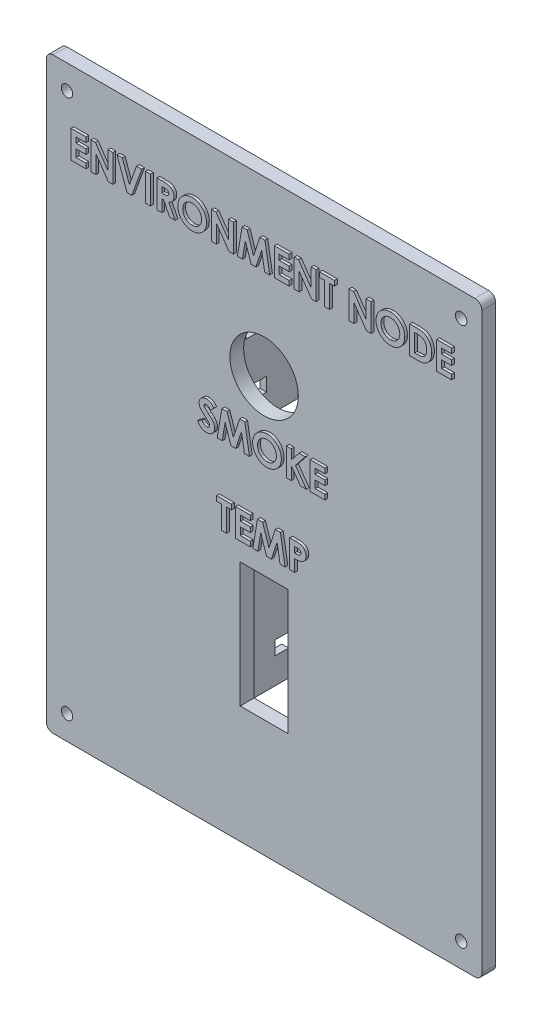
from build123d import *

# Parameters (mm, degrees)
PANEL_DEPTH            = 4
SKETCH2_R              = 1.65
SCREW_HOLES_DEPTH      = 182.34221792
SKETCH3_W              = 30
SKETCH3_H              = 2
SKETCH3_W_2            = 2
SKETCH3_H_2            = 30
LOCATING_TABS_DEPTH    = 3
SKETCH4_R              = 9.905
MQ_2_CAN_HOLE_DEPTH    = 182.34221792
SKETCH5_W              = 2
SKETCH5_H              = 32.52
MQ_2_RAILS_DEPTH       = 16
SKETCH6_W              = 6
SKETCH6_H              = 4
MQ_2_TIE_SLOTS_DEPTH   = 188.002840888
SKETCH7_W              = 13.8
SKETCH7_H              = 36.1
DHT22_WINDOW_DEPTH     = 183.002747232
SKETCH8_W              = 2
SKETCH8_H              = 38.1
DHT22_RAILS_DEPTH      = 11
SKETCH9_W              = 4
SKETCH9_H              = 4
DHT22_TIE_SLOTS_DEPTH  = 187.057007393
SKETCH10_W             = 19.8
SKETCH10_H             = 2
DHT22_POCKET_TOP_DEPTH = 11
SKETCH11_W             = 1.435897436
SKETCH11_H             = 8
LABELS_RAISED_DEPTH    = 0.8


with BuildPart() as part:
    # Sketch1 → Panel (new body)
    with BuildSketch(Plane.XY):
        with BuildLine():
            Line((-61, 0), (61, 0))
            ThreePointArc((61, 0), (62.414213562, 0.585786438), (63, 2))
            Line((63, 2), (63, 168))
            ThreePointArc((63, 168), (62.414213562, 169.414213562), (61, 170))
            Line((61, 170), (-61, 170))
            ThreePointArc((-61, 170), (-62.414213562, 169.414213562), (-63, 168))
            Line((-63, 168), (-63, 2))
            ThreePointArc((-63, 2), (-62.414213562, 0.585786438), (-61, 0))
        make_face()
    extrude(amount=PANEL_DEPTH)

    # Sketch2 → Screw holes (cut, through all)
    with BuildSketch(Plane.XY):
        with Locations((-57, 7)):
            Circle(SKETCH2_R)
        with Locations((57, 7)):
            Circle(SKETCH2_R)
        with Locations((-57, 163)):
            Circle(SKETCH2_R)
        with Locations((57, 163)):
            Circle(SKETCH2_R)
    extrude(amount=SCREW_HOLES_DEPTH, mode=Mode.SUBTRACT)

    # Sketch3 → Locating tabs (add)
    with BuildSketch(Plane.XY.offset(-3)):
        with Locations((0, 4.3)):
            Rectangle(SKETCH3_W, SKETCH3_H)
        with Locations((0, 165.7)):
            Rectangle(SKETCH3_W, SKETCH3_H)
        with Locations((-57.457359313, 85)):
            Rectangle(SKETCH3_W_2, SKETCH3_H_2)
        with Locations((57.457359313, 85)):
            Rectangle(SKETCH3_W_2, SKETCH3_H_2)
    extrude(amount=LOCATING_TABS_DEPTH)

    # Sketch4 → MQ-2 can hole (cut, through all)
    with BuildSketch(Plane.XY):
        with Locations((0, 120)):
            Circle(SKETCH4_R)
    extrude(amount=MQ_2_CAN_HOLE_DEPTH, mode=Mode.SUBTRACT)

    # Sketch5 → MQ-2 rails (add)
    with BuildSketch(Plane.XY.offset(-16)):
        with Locations((-11.25, 115.54)):
            Rectangle(SKETCH5_W, SKETCH5_H)
        with Locations((11.25, 115.54)):
            Rectangle(SKETCH5_W, SKETCH5_H)
    extrude(amount=MQ_2_RAILS_DEPTH)

    # Sketch6 → MQ-2 tie slots (cut, through all)
    with BuildSketch(Plane(origin=(-13.25, 0, 0), x_dir=(0, 0, -1), z_dir=(1, 0, 0))):
        with Locations((4, 107.41)):
            Rectangle(SKETCH6_W, SKETCH6_H)
        with Locations((4, 123.67)):
            Rectangle(SKETCH6_W, SKETCH6_H)
    extrude(amount=MQ_2_TIE_SLOTS_DEPTH, mode=Mode.SUBTRACT)

    # Sketch7 → DHT22 window (cut, through all)
    with BuildSketch(Plane.XY):
        with Locations((0, 52)):
            Rectangle(SKETCH7_W, SKETCH7_H)
    extrude(amount=DHT22_WINDOW_DEPTH, mode=Mode.SUBTRACT)

    # Sketch8 → DHT22 rails (add)
    with BuildSketch(Plane.XY.offset(-11)):
        with Locations((-8.9, 52)):
            Rectangle(SKETCH8_W, SKETCH8_H)
        with Locations((8.9, 52)):
            Rectangle(SKETCH8_W, SKETCH8_H)
    extrude(amount=DHT22_RAILS_DEPTH)

    # Sketch9 → DHT22 tie slots (cut, through all)
    with BuildSketch(Plane(origin=(-10.9, 0, 0), x_dir=(0, 0, -1), z_dir=(1, 0, 0))):
        with Locations((9, 42.475)):
            Rectangle(SKETCH9_W, SKETCH9_H)
        with Locations((9, 61.525)):
            Rectangle(SKETCH9_W, SKETCH9_H)
    extrude(amount=DHT22_TIE_SLOTS_DEPTH, mode=Mode.SUBTRACT)

    # Sketch10 → DHT22 pocket top (add)
    with BuildSketch(Plane.XY.offset(-11)):
        with Locations((0, 72.05)):
            Rectangle(SKETCH10_W, SKETCH10_H)
    extrude(amount=DHT22_POCKET_TOP_DEPTH)

    # Sketch11 → Labels (raised) (add)
    # profile 1 of 24: a face of its own
    with BuildSketch(Plane.XY.offset(4)):
        Polygon((-55.025641026, 155), (-50.717948718, 155), (-50.717948718, 153.564102564), (-53.58974359, 153.564102564), (-53.58974359, 152.025641026), (-50.717948718, 152.025641026), (-50.717948718, 150.58974359), (-53.58974359, 150.58974359), (-53.58974359, 148.435897436), (-50.717948718, 148.435897436), (-50.717948718, 147), (-55.025641026, 147), align=None)
    # profile 2 of 24: a face of its own
    with BuildSketch(Plane.XY.offset(4)):
        Polygon((-49.282051282, 155), (-47.988782051, 155), (-44.358974359, 149.735576923), (-44.358974359, 155), (-42.923076923, 155), (-42.923076923, 147), (-44.225961538, 147), (-47.846153846, 152.248397436), (-47.846153846, 147), (-49.282051282, 147), align=None)
    # profile 3 of 24: a face of its own
    with BuildSketch(Plane.XY.offset(4)):
        Polygon((-41.743589744, 155), (-40.209935897, 155), (-38.153846154, 149.317307692), (-36.096153846, 155), (-34.564102564, 155), (-37.463141026, 147), (-38.84775641, 147), align=None)
    # profile 4 of 24: a face of its own
    with BuildSketch(Plane.XY.offset(4)):
        with Locations((-32.769230769, 151)):
            Rectangle(SKETCH11_W, SKETCH11_H)
    # profile 5 of 24: a face of its own
    with BuildSketch(Plane.XY.offset(4)):
        with BuildLine():
            Line((-30.205128205, 155), (-28.532051282, 155))
            add(Edge.make_bspline(
                [(-28.532051282, 155), (-28.421461407, 154.999607469), (-28.208765925, 154.998852523), (-27.902070657, 154.98694146), (-27.620328877, 154.97036624), (-27.363123439, 154.945072013), (-27.13056438, 154.911534926), (-26.922418622, 154.87200025), (-26.738692249, 154.826942011), (-26.577835782, 154.770795889), (-26.432670775, 154.707463916), (-26.297356807, 154.634694317), (-26.16890865, 154.553297406), (-26.048184841, 154.461131408), (-25.934136263, 154.359854368), (-25.826547756, 154.249364341), (-25.726939644, 154.128724416), (-25.635928706, 153.998696884), (-25.552979563, 153.861910903), (-25.479669917, 153.718178664), (-25.420054391, 153.567400211), (-25.367377683, 153.411754618), (-25.329436357, 153.249016901), (-25.30304872, 153.08077134), (-25.283728724, 152.906425691), (-25.282617917, 152.787982999), (-25.282051282, 152.727564103)],
                knots=[0, 0, 0, 0, 1.749336639, 3.364467119, 4.854658419, 6.213483162, 7.451590619, 8.570285859, 9.5643256, 10.440900261, 11.26203566, 12.067320669, 12.869050712, 13.665104639, 14.467235401, 15.27997916, 16.102287765, 16.939272006, 17.78853747, 18.631303466, 19.488103222, 20.351255419, 21.228522269, 22.127379805, 23.044756219, 24, 24, 24, 24], degree=3))
            add(Edge.make_bspline(
                [(-25.282051282, 152.727564103), (-25.283523196, 152.664500654), (-25.28640935, 152.540844726), (-25.301955746, 152.359204253), (-25.330369676, 152.185423354), (-25.373406706, 152.020010837), (-25.422872182, 151.860907952), (-25.488648576, 151.711050245), (-25.562883738, 151.568258254), (-25.651050671, 151.434551826), (-25.747809573, 151.306961072), (-25.86033814, 151.19037447), (-25.98134625, 151.07852593), (-26.11763621, 150.978421265), (-26.263200231, 150.883291759), (-26.420930518, 150.797079093), (-26.589797668, 150.717616079), (-26.708519637, 150.673302013), (-26.769230769, 150.650641026)],
                knots=[0, 0, 0, 0, 1.099860209, 2.156625411, 3.176576793, 4.16617041, 5.135385252, 6.078461593, 7.016046972, 7.938469504, 8.868247731, 9.803980173, 10.76021508, 11.73834243, 12.748633912, 13.790971185, 14.870363756, 16, 16, 16, 16], degree=3))
            Line((-26.769230769, 150.650641026), (-24.923076923, 147))
            Line((-24.923076923, 147), (-26.519230769, 147))
            Line((-26.519230769, 147), (-28.282051282, 150.487179487))
            Line((-28.282051282, 150.487179487), (-28.769230769, 150.487179487))
            Line((-28.769230769, 150.487179487), (-28.769230769, 147))
            Line((-28.769230769, 147), (-30.205128205, 147))
            Line((-30.205128205, 147), (-30.205128205, 155))
        make_face()
        with BuildLine():
            Line((-28.769230769, 151.923076923), (-28.209935897, 151.923076923))
            add(Edge.make_bspline(
                [(-28.209935897, 151.923076923), (-28.14155745, 151.923847047), (-28.010627416, 151.925321669), (-27.822332831, 151.932161577), (-27.651316442, 151.948642376), (-27.496843847, 151.96946525), (-27.358137754, 151.993508265), (-27.236435372, 152.027963365), (-27.129861453, 152.064882876), (-27.039678902, 152.110764253), (-26.962629003, 152.162941328), (-26.896101347, 152.222215784), (-26.841073436, 152.290818418), (-26.795782658, 152.366884908), (-26.760551358, 152.451088043), (-26.734835207, 152.542503463), (-26.720463682, 152.642172507), (-26.718810189, 152.710957719), (-26.717948718, 152.746794872)],
                knots=[0, 0, 0, 0, 1.688639943, 3.233382647, 4.650958383, 5.928841754, 7.082724185, 8.122798841, 9.049171256, 9.863274652, 10.613301712, 11.341792392, 12.054588806, 12.776240173, 13.521029143, 14.301969904, 15.115324896, 16, 16, 16, 16], degree=3))
            add(Edge.make_bspline(
                [(-26.717948718, 152.746794872), (-26.719577408, 152.78919284), (-26.722776668, 152.872475792), (-26.754523268, 152.99237404), (-26.805056998, 153.103348072), (-26.8743249, 153.20489648), (-26.961558818, 153.293920824), (-27.061666621, 153.372396492), (-27.176808877, 153.434449179), (-27.283421942, 153.47537847), (-27.380414911, 153.499866888), (-27.467948006, 153.51811544), (-27.569311856, 153.531048712), (-27.684582987, 153.54476675), (-27.813467567, 153.553662203), (-27.956668096, 153.560154111), (-28.113773302, 153.562810269), (-28.223290552, 153.563659396), (-28.280448718, 153.564102564)],
                knots=[0, 0, 0, 0, 1.020303359, 2.004196876, 2.966617323, 3.9489082, 4.950758222, 5.960522915, 7.003732012, 8.091992268, 8.70421221, 9.413913587, 10.24622431, 11.166358409, 12.212345909, 13.359657661, 14.621978493, 16, 16, 16, 16], degree=3))
            Line((-28.280448718, 153.564102564), (-28.769230769, 153.564102564))
            Line((-28.769230769, 153.564102564), (-28.769230769, 151.923076923))
        make_face(mode=Mode.SUBTRACT)
    # profile 6 of 24: a face of its own
    with BuildSketch(Plane.XY.offset(4)):
        with BuildLine():
            add(Edge.make_bspline(
                [(-19.983974359, 155.205128205), (-19.844884554, 155.201526921), (-19.570289777, 155.19441717), (-19.166459951, 155.135151851), (-18.777295245, 155.038587509), (-18.402971639, 154.90435609), (-18.044426397, 154.728821924), (-17.700394809, 154.51696152), (-17.372109179, 154.26477614), (-17.062933517, 153.978148853), (-16.777199443, 153.666454193), (-16.529610702, 153.330859477), (-16.318476107, 152.980060302), (-16.143487189, 152.613116689), (-16.010200557, 152.22748738), (-15.916667815, 151.825138574), (-15.856577662, 151.406184737), (-15.84966637, 151.120934277), (-15.846153846, 150.975961538)],
                knots=[0, 0, 0, 0, 1.014329547, 2.002516266, 2.970391464, 3.935626869, 4.897733899, 5.877609409, 6.878433252, 7.912639331, 8.949961323, 9.958554974, 10.949718813, 11.932905612, 12.9188844, 13.919928257, 14.942845884, 16, 16, 16, 16], degree=3))
            add(Edge.make_bspline(
                [(-15.846153846, 150.975961538), (-15.849894532, 150.832622308), (-15.857265673, 150.550167754), (-15.914214672, 150.135074742), (-16.009322517, 149.73703593), (-16.140348503, 149.35515035), (-16.312163783, 148.991267724), (-16.519181024, 148.643064713), (-16.766863018, 148.313772723), (-17.046175828, 148.003568465), (-17.353674992, 147.721991539), (-17.679365423, 147.473852359), (-18.021743281, 147.263588582), (-18.380307436, 147.091296519), (-18.755826811, 146.957586994), (-19.147373827, 146.863245208), (-19.554924256, 146.8059118), (-19.832078311, 146.798588806), (-19.97275641, 146.794871795)],
                knots=[0, 0, 0, 0, 1.051557043, 2.072126891, 3.067553643, 4.050577992, 5.02905126, 6.015227836, 7.017913613, 8.04756643, 9.074058332, 10.072836633, 11.047628519, 12.017157415, 12.98668631, 13.966869689, 14.968021931, 16, 16, 16, 16], degree=3))
            add(Edge.make_bspline(
                [(-19.97275641, 146.794871795), (-20.119888834, 146.798206137), (-20.408983935, 146.804757665), (-20.832075909, 146.867059697), (-21.237434579, 146.960908322), (-21.621654697, 147.100972361), (-21.988649219, 147.276064186), (-22.335721726, 147.491700266), (-22.66275558, 147.747524246), (-22.967874862, 148.036984379), (-23.244313669, 148.353717252), (-23.488325141, 148.688317446), (-23.69415423, 149.038228907), (-23.861808468, 149.403615404), (-23.993980334, 149.782206146), (-24.087212569, 150.176306862), (-24.142287074, 150.584972355), (-24.149958633, 150.862546127), (-24.153846154, 151.003205128)],
                knots=[0, 0, 0, 0, 1.067978421, 2.098431617, 3.099715153, 4.085208694, 5.062210972, 6.048429807, 7.046490867, 8.072918869, 9.098532598, 10.095778865, 11.076610158, 12.041847152, 13.011192615, 13.984257998, 14.978533688, 16, 16, 16, 16], degree=3))
            add(Edge.make_bspline(
                [(-24.153846154, 151.003205128), (-24.152626026, 151.097833141), (-24.15020122, 151.285890958), (-24.120991873, 151.564583044), (-24.078938812, 151.837835435), (-24.01674433, 152.104558669), (-23.941193931, 152.366634355), (-23.843307717, 152.621623027), (-23.731886715, 152.872248666), (-23.601701764, 153.115551069), (-23.456948687, 153.349291651), (-23.299010193, 153.572367816), (-23.127489146, 153.782082248), (-22.942938073, 153.979813103), (-22.744720987, 154.164260682), (-22.535445227, 154.338036098), (-22.311052064, 154.496523257), (-22.076452759, 154.643592732), (-21.832969929, 154.776585108), (-21.581594771, 154.88978424), (-21.327506108, 154.988639115), (-21.06730966, 155.066659753), (-20.803793894, 155.130206746), (-20.534143677, 155.172231464), (-20.260795147, 155.201440001), (-20.076466939, 155.203895886), (-19.983974359, 155.205128205)],
                knots=[0, 0, 0, 0, 1.034744296, 2.056386356, 3.06226378, 4.057406941, 5.050368692, 6.043467995, 7.042652155, 8.049140477, 9.059438543, 10.048523776, 11.036952808, 12.020949711, 13.004946614, 13.997082645, 14.994316842, 16.007702937, 17.024872941, 18.026463647, 19.021641123, 20.005082605, 20.995858141, 21.984425357, 22.988620895, 24, 24, 24, 24], degree=3))
        make_face()
        with BuildLine():
            add(Edge.make_bspline(
                [(-20.006410256, 153.769230769), (-20.100017676, 153.766719072), (-20.284761265, 153.761761987), (-20.555746465, 153.723995701), (-20.815901827, 153.663678651), (-21.063785207, 153.576310141), (-21.300470953, 153.465112201), (-21.526378635, 153.330473372), (-21.738379899, 153.167765593), (-21.939301577, 152.985723921), (-22.120801252, 152.782887662), (-22.281161939, 152.565514114), (-22.415358006, 152.333966289), (-22.527748053, 152.090395209), (-22.612352849, 151.832061984), (-22.672614308, 151.560990165), (-22.710697301, 151.276712682), (-22.71549771, 151.082921092), (-22.717948718, 150.983974359)],
                knots=[0, 0, 0, 0, 1.033739768, 2.040188636, 3.016340934, 3.979330865, 4.937572243, 5.900995986, 6.878200029, 7.884839167, 8.891893314, 9.879764717, 10.863503415, 11.843163062, 12.837761627, 13.859916423, 14.907309254, 16, 16, 16, 16], degree=3))
            add(Edge.make_bspline(
                [(-22.717948718, 150.983974359), (-22.714699056, 150.874319122), (-22.708330256, 150.659413025), (-22.663518604, 150.345913802), (-22.58685033, 150.0498449), (-22.476142833, 149.772654349), (-22.338836491, 149.511264155), (-22.168323807, 149.268878026), (-21.967366278, 149.044044668), (-21.812550227, 148.912777588), (-21.733974359, 148.846153846)],
                knots=[0, 0, 0, 0, 1.078454662, 2.113592447, 3.107694534, 4.079536787, 5.043276885, 6.005368276, 6.987637804, 8, 8, 8, 8], degree=3))
            add(Edge.make_bspline(
                [(-21.733974359, 148.846153846), (-21.669605722, 148.796934785), (-21.542318685, 148.699605575), (-21.339140862, 148.574858227), (-21.129907711, 148.467937305), (-20.913040307, 148.381546465), (-20.688996662, 148.313592882), (-20.457807499, 148.266006106), (-20.219800395, 148.236141288), (-20.058848837, 148.232571877), (-19.977564103, 148.230769231)],
                knots=[0, 0, 0, 0, 1.023928204, 2.024787132, 3.009472467, 3.9914905, 4.972207045, 5.96565515, 6.972602802, 8, 8, 8, 8], degree=3))
            add(Edge.make_bspline(
                [(-19.977564103, 148.230769231), (-19.885566264, 148.233302224), (-19.704557624, 148.238285969), (-19.43861696, 148.275587331), (-19.183837727, 148.338714702), (-18.938638233, 148.425316785), (-18.703725524, 148.537910911), (-18.480247683, 148.676725814), (-18.267812893, 148.840057027), (-18.067147186, 149.024489306), (-17.883729244, 149.228124599), (-17.723703196, 149.446657595), (-17.585240365, 149.675273356), (-17.475187471, 149.917207593), (-17.387240131, 150.170176559), (-17.327703949, 150.4353006), (-17.289299241, 150.711486773), (-17.28449748, 150.899441224), (-17.282051282, 150.995192308)],
                knots=[0, 0, 0, 0, 1.026359118, 2.019393844, 2.989460624, 3.950973911, 4.916101784, 5.890408035, 6.881132271, 7.902007068, 8.92769091, 9.933912415, 10.920395702, 11.90457117, 12.894218921, 13.903490204, 14.931958862, 16, 16, 16, 16], degree=3))
            add(Edge.make_bspline(
                [(-17.282051282, 150.995192308), (-17.284582119, 151.090392797), (-17.289563686, 151.27778044), (-17.3269307, 151.55325654), (-17.389657734, 151.817210136), (-17.476519874, 152.070072291), (-17.587438226, 152.312090904), (-17.724600022, 152.542414895), (-17.887523977, 152.760821597), (-18.072460406, 152.965822652), (-18.273752342, 153.154205489), (-18.489859349, 153.317687547), (-18.714734509, 153.459748258), (-18.953537556, 153.571032883), (-19.20138278, 153.659693107), (-19.459782545, 153.724983769), (-19.729715556, 153.761496677), (-19.913356565, 153.766629759), (-20.006410256, 153.769230769)],
                knots=[0, 0, 0, 0, 1.055025985, 2.07665775, 3.074803781, 4.057872707, 5.035505728, 6.020516407, 7.023567878, 8.050795229, 9.077271434, 10.074415901, 11.050397877, 12.019801805, 12.988065821, 13.964604439, 14.968634123, 16, 16, 16, 16], degree=3))
        make_face(mode=Mode.SUBTRACT)
    # profile 7 of 24: a face of its own
    with BuildSketch(Plane.XY.offset(4)):
        Polygon((-14.41025641, 155), (-13.116987179, 155), (-9.487179487, 149.735576923), (-9.487179487, 155), (-8.051282051, 155), (-8.051282051, 147), (-9.354166667, 147), (-12.974358974, 152.248397436), (-12.974358974, 147), (-14.41025641, 147), align=None)
    # profile 8 of 24: a face of its own
    with BuildSketch(Plane.XY.offset(4)):
        Polygon((-5.572115385, 155), (-4.084935897, 155), (-2.256410256, 149.419871795), (-0.418269231, 155), (1.057692308, 155), (2.41025641, 147), (0.956730769, 147), (0.102564103, 152.052884615), (-1.560897436, 147), (-2.959935897, 147), (-4.615384615, 152.052884615), (-5.467948718, 147), (-6.923076923, 147), align=None)
    # profile 9 of 24: a face of its own
    with BuildSketch(Plane.XY.offset(4)):
        Polygon((3.743589744, 155), (8.051282051, 155), (8.051282051, 153.564102564), (5.179487179, 153.564102564), (5.179487179, 152.025641026), (8.051282051, 152.025641026), (8.051282051, 150.58974359), (5.179487179, 150.58974359), (5.179487179, 148.435897436), (8.051282051, 148.435897436), (8.051282051, 147), (3.743589744, 147), align=None)
    # profile 10 of 24: a face of its own
    with BuildSketch(Plane.XY.offset(4)):
        Polygon((9.487179487, 155), (10.780448718, 155), (14.41025641, 149.735576923), (14.41025641, 155), (15.846153846, 155), (15.846153846, 147), (14.543269231, 147), (10.923076923, 152.248397436), (10.923076923, 147), (9.487179487, 147), align=None)
    # profile 11 of 24: a face of its own
    with BuildSketch(Plane.XY.offset(4)):
        Polygon((16.871794872, 155), (21.179487179, 155), (21.179487179, 153.564102564), (19.743589744, 153.564102564), (19.743589744, 147), (18.307692308, 147), (18.307692308, 153.564102564), (16.871794872, 153.564102564), align=None)
    # profile 12 of 24: a face of its own
    with BuildSketch(Plane.XY.offset(4)):
        Polygon((25.384615385, 155), (26.677884615, 155), (30.307692308, 149.735576923), (30.307692308, 155), (31.743589744, 155), (31.743589744, 147), (30.440705128, 147), (26.820512821, 152.248397436), (26.820512821, 147), (25.384615385, 147), align=None)
    # profile 13 of 24: a face of its own
    with BuildSketch(Plane.XY.offset(4)):
        with BuildLine():
            add(Edge.make_bspline(
                [(37.349358974, 155.205128205), (37.488448779, 155.201526921), (37.763043556, 155.19441717), (38.166873383, 155.135151851), (38.556038088, 155.038587509), (38.930361694, 154.90435609), (39.288906936, 154.728821924), (39.632938525, 154.51696152), (39.961224154, 154.26477614), (40.270399817, 153.978148853), (40.55613389, 153.666454193), (40.803722631, 153.330859477), (41.014857227, 152.980060302), (41.189846144, 152.613116689), (41.323132776, 152.22748738), (41.416665518, 151.825138574), (41.476755671, 151.406184737), (41.483666964, 151.120934277), (41.487179487, 150.975961538)],
                knots=[0, 0, 0, 0, 1.014329547, 2.002516266, 2.970391464, 3.935626869, 4.897733899, 5.877609409, 6.878433252, 7.912639331, 8.949961323, 9.958554974, 10.949718813, 11.932905612, 12.9188844, 13.919928257, 14.942845884, 16, 16, 16, 16], degree=3))
            add(Edge.make_bspline(
                [(41.487179487, 150.975961538), (41.483438802, 150.832622308), (41.476067661, 150.550167754), (41.419118662, 150.135074742), (41.324010816, 149.73703593), (41.19298483, 149.35515035), (41.02116955, 148.991267724), (40.814152309, 148.643064713), (40.566470316, 148.313772723), (40.287157505, 148.003568465), (39.979658341, 147.721991539), (39.653967911, 147.473852359), (39.311590052, 147.263588582), (38.953025898, 147.091296519), (38.577506523, 146.957586994), (38.185959506, 146.863245208), (37.778409078, 146.8059118), (37.501255022, 146.798588806), (37.360576923, 146.794871795)],
                knots=[0, 0, 0, 0, 1.051557043, 2.072126891, 3.067553643, 4.050577992, 5.02905126, 6.015227836, 7.017913613, 8.04756643, 9.074058332, 10.072836633, 11.047628519, 12.017157415, 12.98668631, 13.966869689, 14.968021931, 16, 16, 16, 16], degree=3))
            add(Edge.make_bspline(
                [(37.360576923, 146.794871795), (37.2134445, 146.798206137), (36.924349399, 146.804757665), (36.501257424, 146.867059697), (36.095898755, 146.960908322), (35.711678636, 147.100972361), (35.344684115, 147.276064186), (34.997611607, 147.491700266), (34.670577753, 147.747524246), (34.365458472, 148.036984379), (34.089019664, 148.353717252), (33.845008192, 148.688317446), (33.639179103, 149.038228907), (33.471524865, 149.403615404), (33.339352999, 149.782206146), (33.246120765, 150.176306862), (33.191046259, 150.584972355), (33.1833747, 150.862546127), (33.179487179, 151.003205128)],
                knots=[0, 0, 0, 0, 1.067978421, 2.098431617, 3.099715153, 4.085208694, 5.062210972, 6.048429807, 7.046490867, 8.072918869, 9.098532598, 10.095778865, 11.076610158, 12.041847152, 13.011192615, 13.984257998, 14.978533688, 16, 16, 16, 16], degree=3))
            add(Edge.make_bspline(
                [(33.179487179, 151.003205128), (33.180707307, 151.097833141), (33.183132114, 151.285890958), (33.21234146, 151.564583044), (33.254394521, 151.837835435), (33.316589003, 152.104558669), (33.392139402, 152.366634355), (33.490025616, 152.621623027), (33.601446619, 152.872248666), (33.731631569, 153.115551069), (33.876384646, 153.349291651), (34.034323141, 153.572367816), (34.205844188, 153.782082248), (34.39039526, 153.979813103), (34.588612347, 154.164260682), (34.797888106, 154.338036098), (35.022281269, 154.496523257), (35.256880574, 154.643592732), (35.500363404, 154.776585108), (35.751738563, 154.88978424), (36.005827225, 154.988639115), (36.266023673, 155.066659753), (36.52953944, 155.130206746), (36.799189656, 155.172231464), (37.072538187, 155.201440001), (37.256866395, 155.203895886), (37.349358974, 155.205128205)],
                knots=[0, 0, 0, 0, 1.034744296, 2.056386356, 3.06226378, 4.057406941, 5.050368692, 6.043467995, 7.042652155, 8.049140477, 9.059438543, 10.048523776, 11.036952808, 12.020949711, 13.004946614, 13.997082645, 14.994316842, 16.007702937, 17.024872941, 18.026463647, 19.021641123, 20.005082605, 20.995858141, 21.984425357, 22.988620895, 24, 24, 24, 24], degree=3))
        make_face()
        with BuildLine():
            add(Edge.make_bspline(
                [(37.326923077, 153.769230769), (37.233315657, 153.766719072), (37.048572068, 153.761761987), (36.777586868, 153.723995701), (36.517431506, 153.663678651), (36.269548126, 153.576310141), (36.032862381, 153.465112201), (35.806954698, 153.330473372), (35.594953434, 153.167765593), (35.394031756, 152.985723921), (35.212532082, 152.782887662), (35.052171394, 152.565514114), (34.917975327, 152.333966289), (34.80558528, 152.090395209), (34.720980484, 151.832061984), (34.660719025, 151.560990165), (34.622636032, 151.276712682), (34.617835623, 151.082921092), (34.615384615, 150.983974359)],
                knots=[0, 0, 0, 0, 1.033739768, 2.040188636, 3.016340934, 3.979330865, 4.937572243, 5.900995986, 6.878200029, 7.884839167, 8.891893314, 9.879764717, 10.863503415, 11.843163062, 12.837761627, 13.859916423, 14.907309254, 16, 16, 16, 16], degree=3))
            add(Edge.make_bspline(
                [(34.615384615, 150.983974359), (34.618634278, 150.874319122), (34.625003078, 150.659413025), (34.669814729, 150.345913802), (34.746483003, 150.0498449), (34.857190501, 149.772654349), (34.994496842, 149.511264155), (35.165009526, 149.268878026), (35.365967055, 149.044044668), (35.520783107, 148.912777588), (35.599358974, 148.846153846)],
                knots=[0, 0, 0, 0, 1.078454662, 2.113592447, 3.107694534, 4.079536787, 5.043276885, 6.005368276, 6.987637804, 8, 8, 8, 8], degree=3))
            add(Edge.make_bspline(
                [(35.599358974, 148.846153846), (35.663727611, 148.796934785), (35.791014648, 148.699605575), (35.994192471, 148.574858227), (36.203425622, 148.467937305), (36.420293026, 148.381546465), (36.644336671, 148.313592882), (36.875525834, 148.266006106), (37.113532938, 148.236141288), (37.274484497, 148.232571877), (37.355769231, 148.230769231)],
                knots=[0, 0, 0, 0, 1.023928204, 2.024787132, 3.009472467, 3.9914905, 4.972207045, 5.96565515, 6.972602802, 8, 8, 8, 8], degree=3))
            add(Edge.make_bspline(
                [(37.355769231, 148.230769231), (37.447767069, 148.233302224), (37.628775709, 148.238285969), (37.894716373, 148.275587331), (38.149495607, 148.338714702), (38.394695101, 148.425316785), (38.629607809, 148.537910911), (38.85308565, 148.676725814), (39.065520441, 148.840057027), (39.266186147, 149.024489306), (39.449604089, 149.228124599), (39.609630137, 149.446657595), (39.748092968, 149.675273356), (39.858145862, 149.917207593), (39.946093203, 150.170176559), (40.005629384, 150.4353006), (40.044034092, 150.711486773), (40.048835853, 150.899441224), (40.051282051, 150.995192308)],
                knots=[0, 0, 0, 0, 1.026359118, 2.019393844, 2.989460624, 3.950973911, 4.916101784, 5.890408035, 6.881132271, 7.902007068, 8.92769091, 9.933912415, 10.920395702, 11.90457117, 12.894218921, 13.903490204, 14.931958862, 16, 16, 16, 16], degree=3))
            add(Edge.make_bspline(
                [(40.051282051, 150.995192308), (40.048751214, 151.090392797), (40.043769648, 151.27778044), (40.006402634, 151.55325654), (39.9436756, 151.817210136), (39.85681346, 152.070072291), (39.745895107, 152.312090904), (39.608733311, 152.542414895), (39.445809357, 152.760821597), (39.260872928, 152.965822652), (39.059580991, 153.154205489), (38.843473985, 153.317687547), (38.618598824, 153.459748258), (38.379795777, 153.571032883), (38.131950553, 153.659693107), (37.873550788, 153.724983769), (37.603617777, 153.761496677), (37.419976768, 153.766629759), (37.326923077, 153.769230769)],
                knots=[0, 0, 0, 0, 1.055025985, 2.07665775, 3.074803781, 4.057872707, 5.035505728, 6.020516407, 7.023567878, 8.050795229, 9.077271434, 10.074415901, 11.050397877, 12.019801805, 12.988065821, 13.964604439, 14.968634123, 16, 16, 16, 16], degree=3))
        make_face(mode=Mode.SUBTRACT)
    # profile 14 of 24: a face of its own
    with BuildSketch(Plane.XY.offset(4)):
        with BuildLine():
            Line((42.923076923, 155), (44.732371795, 155))
            add(Edge.make_bspline(
                [(44.732371795, 155), (44.873427141, 154.999013975), (45.146088719, 154.997107977), (45.541121404, 154.975631966), (45.908451533, 154.942603386), (46.248315893, 154.897166588), (46.560017707, 154.837041262), (46.843155043, 154.761625825), (47.098678177, 154.674571249), (47.329388868, 154.572133875), (47.540005538, 154.452702071), (47.739992788, 154.319664629), (47.928957948, 154.168148), (48.109552845, 154.001075241), (48.279446863, 153.815389808), (48.441469347, 153.614167323), (48.591653251, 153.394489784), (48.734538309, 153.161624364), (48.863758831, 152.914584203), (48.976469799, 152.655472055), (49.07088846, 152.385955403), (49.147608512, 152.105747013), (49.208763247, 151.81577709), (49.251551983, 151.515460503), (49.278004406, 151.205075296), (49.280687783, 150.994712), (49.282051282, 150.887820513)],
                knots=[0, 0, 0, 0, 1.44355588, 2.790409838, 4.047694926, 5.217575253, 6.298404546, 7.294384826, 8.214239204, 9.058592145, 9.873746385, 10.689560431, 11.514393297, 12.350027578, 13.205127629, 14.088021785, 14.991911688, 15.926770944, 16.882954281, 17.842803888, 18.816321264, 19.80318086, 20.814351908, 21.847355356, 22.906180909, 24, 24, 24, 24], degree=3))
            add(Edge.make_bspline(
                [(49.282051282, 150.887820513), (49.278480905, 150.736989666), (49.271452409, 150.440070315), (49.212248287, 150.004344588), (49.116495174, 149.58665802), (48.981857602, 149.190277918), (48.814943053, 148.818734104), (48.615544933, 148.478578598), (48.386586884, 148.171637183), (48.130736279, 147.899438175), (47.853712387, 147.665479438), (47.565828701, 147.465110901), (47.264280709, 147.30710359), (46.998574785, 147.206903326), (46.768174601, 147.144587432), (46.565885731, 147.107758138), (46.336106216, 147.073983454), (46.07669356, 147.047883105), (45.788785751, 147.024608007), (45.471235185, 147.011961225), (45.125069999, 147.001453627), (44.884625547, 147.000497239), (44.759615385, 147)],
                knots=[0, 0, 0, 0, 1.315458931, 2.589557908, 3.828601765, 5.048913369, 6.235739168, 7.376350998, 8.481830359, 9.569842114, 10.627874879, 11.640079404, 12.624025415, 13.590060155, 14.111227486, 14.704434459, 15.382649715, 16.137166398, 16.978595427, 17.902333227, 18.909396075, 20, 20, 20, 20], degree=3))
            Line((44.759615385, 147), (42.923076923, 147))
            Line((42.923076923, 147), (42.923076923, 155))
        make_face()
        with BuildLine():
            Line((44.358974359, 153.564102564), (44.358974359, 148.435897436))
            Line((44.358974359, 148.435897436), (45.108974359, 148.435897436))
            add(Edge.make_bspline(
                [(45.108974359, 148.435897436), (45.198212841, 148.436060958), (45.369848149, 148.436375465), (45.617650682, 148.451355702), (45.846805193, 148.466391729), (46.056680874, 148.494930611), (46.248805133, 148.526720918), (46.420538687, 148.570961483), (46.57542171, 148.617432448), (46.711562337, 148.676595747), (46.836256058, 148.743187977), (46.951708202, 148.821208495), (47.063151844, 148.907847338), (47.168503456, 149.005652677), (47.268161769, 149.113329386), (47.361537142, 149.231432276), (47.449875888, 149.35960101), (47.530910518, 149.498513249), (47.604960398, 149.646702048), (47.670650938, 149.802731983), (47.72511809, 149.967902446), (47.770387852, 150.140667244), (47.80273823, 150.322530491), (47.829501997, 150.51214515), (47.843299499, 150.710262458), (47.84519312, 150.845068097), (47.846153846, 150.913461538)],
                knots=[0, 0, 0, 0, 1.50275155, 2.890291501, 4.180787663, 5.369391935, 6.45668281, 7.458360028, 8.354766181, 9.177074746, 9.954075863, 10.732690366, 11.5210699, 12.329727389, 13.151100085, 13.990027547, 14.863562427, 15.770965086, 16.696477834, 17.652329173, 18.619756807, 19.62365428, 20.657822005, 21.729286259, 22.847956731, 24, 24, 24, 24], degree=3))
            add(Edge.make_bspline(
                [(47.846153846, 150.913461538), (47.844240406, 151.018268022), (47.840509347, 151.222632546), (47.804527818, 151.520293934), (47.745956752, 151.800586723), (47.662381484, 152.062470671), (47.557032268, 152.306681809), (47.425163168, 152.531151152), (47.27244932, 152.739649475), (47.151687375, 152.861961281), (47.091346154, 152.923076923)],
                knots=[0, 0, 0, 0, 1.13821349, 2.219428113, 3.251817212, 4.244760574, 5.201143372, 6.134805572, 7.068016741, 8, 8, 8, 8], degree=3))
            add(Edge.make_bspline(
                [(47.091346154, 152.923076923), (47.031843996, 152.975155712), (46.910317575, 153.081520743), (46.696957117, 153.20897325), (46.461844942, 153.320952771), (46.199602388, 153.409740042), (45.912763915, 153.479956801), (45.599621105, 153.528383583), (45.261850906, 153.55950212), (45.027851583, 153.562536229), (44.907051282, 153.564102564)],
                knots=[0, 0, 0, 0, 0.813307809, 1.661089106, 2.549956539, 3.493439533, 4.508053171, 5.589449661, 6.755572447, 8, 8, 8, 8], degree=3))
            Line((44.907051282, 153.564102564), (44.358974359, 153.564102564))
        make_face(mode=Mode.SUBTRACT)
    # profile 15 of 24: a face of its own
    with BuildSketch(Plane.XY.offset(4)):
        Polygon((50.717948718, 155), (55.025641026, 155), (55.025641026, 153.564102564), (52.153846154, 153.564102564), (52.153846154, 152.025641026), (55.025641026, 152.025641026), (55.025641026, 150.58974359), (52.153846154, 150.58974359), (52.153846154, 148.435897436), (55.025641026, 148.435897436), (55.025641026, 147), (50.717948718, 147), align=None)
    # profile 16 of 24: a face of its own
    with BuildSketch(Plane.XY.offset(4)):
        with BuildLine():
            Line((-13.692307692, 105.526089744), (-14.766025641, 104.543717949))
            add(Edge.make_bspline(
                [(-14.766025641, 104.543717949), (-14.812019114, 104.608596524), (-14.900320168, 104.73315434), (-15.043446966, 104.899940193), (-15.185927474, 105.042220936), (-15.329081686, 105.159402189), (-15.474178467, 105.250771987), (-15.62096595, 105.315462813), (-15.768611955, 105.356587385), (-15.86780728, 105.361708384), (-15.916666667, 105.364230769)],
                knots=[0, 0, 0, 0, 1.299362458, 2.494594718, 3.587462134, 4.587049575, 5.512617175, 6.380583204, 7.202344345, 8, 8, 8, 8], degree=3))
            add(Edge.make_bspline(
                [(-15.916666667, 105.364230769), (-15.962241301, 105.36263247), (-16.050233946, 105.359546574), (-16.17567399, 105.328873), (-16.287041448, 105.275934914), (-16.384227629, 105.206713914), (-16.461213423, 105.123318657), (-16.52268061, 105.035858475), (-16.557291801, 104.939322214), (-16.561847315, 104.873017215), (-16.564102564, 104.840192308)],
                knots=[0, 0, 0, 0, 1.185010067, 2.2879431, 3.333075148, 4.379039566, 5.372662701, 6.27520591, 7.14612461, 8, 8, 8, 8], degree=3))
            add(Edge.make_bspline(
                [(-16.564102564, 104.840192308), (-16.562689314, 104.80689405), (-16.559843223, 104.739835988), (-16.532353866, 104.641554046), (-16.490919555, 104.545521147), (-16.45132738, 104.487061352), (-16.431089744, 104.457179487)],
                knots=[0, 0, 0, 0, 0.967525499, 1.948461899, 2.951351359, 4, 4, 4, 4], degree=3))
            add(Edge.make_bspline(
                [(-16.431089744, 104.457179487), (-16.412691543, 104.433952626), (-16.370341316, 104.38048746), (-16.289588107, 104.29580697), (-16.188179035, 104.192065958), (-16.062211667, 104.072831774), (-15.916915254, 103.933816288), (-15.74555512, 103.780484254), (-15.553063757, 103.608087156), (-15.416245356, 103.48803606), (-15.344551282, 103.425128205)],
                knots=[0, 0, 0, 0, 0.473873513, 1.090794244, 1.870441696, 2.795289791, 3.865433203, 5.087734844, 6.473946851, 8, 8, 8, 8], degree=3))
            add(Edge.make_bspline(
                [(-15.344551282, 103.425128205), (-15.277256081, 103.366887603), (-15.14954377, 103.25635904), (-14.967834514, 103.099481491), (-14.808142341, 102.958342586), (-14.6681409, 102.835060517), (-14.549952478, 102.728341773), (-14.45308021, 102.63767624), (-14.376340964, 102.564829009), (-14.332719196, 102.520829237), (-14.314102564, 102.502051282)],
                knots=[0, 0, 0, 0, 1.543621617, 2.929473131, 4.163658386, 5.240097082, 6.164993805, 6.925417477, 7.541396219, 8, 8, 8, 8], degree=3))
            add(Edge.make_bspline(
                [(-14.314102564, 102.502051282), (-14.243474942, 102.425617069), (-14.10770385, 102.27868367), (-13.931249293, 102.05098311), (-13.786021485, 101.828700934), (-13.673670498, 101.607654544), (-13.588818514, 101.384654678), (-13.528996741, 101.154232278), (-13.493169084, 100.913979574), (-13.489191377, 100.750036433), (-13.487179487, 100.667115385)],
                knots=[0, 0, 0, 0, 1.206664779, 2.319633467, 3.337109185, 4.282041471, 5.190008762, 6.099243693, 7.03861361, 8, 8, 8, 8], degree=3))
            add(Edge.make_bspline(
                [(-13.487179487, 100.667115385), (-13.488611499, 100.586318993), (-13.49142116, 100.427793465), (-13.525834114, 100.195814968), (-13.574904968, 99.973801479), (-13.650777116, 99.764168817), (-13.743249641, 99.563475928), (-13.859177306, 99.374848967), (-13.995318453, 99.196378953), (-14.151357111, 99.031256255), (-14.323954395, 98.881418853), (-14.509081386, 98.748030058), (-14.708548349, 98.637900617), (-14.920651068, 98.547216877), (-15.145276011, 98.477371049), (-15.38215558, 98.425748472), (-15.631652101, 98.394765415), (-15.802261417, 98.391526504), (-15.889423077, 98.389871795)],
                knots=[0, 0, 0, 0, 1.043214005, 2.046824704, 3.02475056, 3.976699089, 4.921714032, 5.875962561, 6.831408892, 7.817874052, 8.806269674, 9.781291748, 10.760897367, 11.74438705, 12.757449933, 13.795994037, 14.874007457, 16, 16, 16, 16], degree=3))
            add(Edge.make_bspline(
                [(-15.889423077, 98.389871795), (-15.957844238, 98.391085632), (-16.093357375, 98.393489725), (-16.293083253, 98.413117146), (-16.485941165, 98.444793716), (-16.671713876, 98.490195702), (-16.851238323, 98.547726176), (-17.024521879, 98.617997447), (-17.190368311, 98.702098693), (-17.350032492, 98.798300457), (-17.502738255, 98.910003377), (-17.650416507, 99.034923723), (-17.791600365, 99.174982827), (-17.926967908, 99.329849454), (-18.055653016, 99.499962148), (-18.181868014, 99.682951777), (-18.300003529, 99.882214378), (-18.372981091, 100.021998705), (-18.41025641, 100.093397436)],
                knots=[0, 0, 0, 0, 1.016823716, 2.013894106, 2.979844003, 3.91962641, 4.853723003, 5.779685073, 6.695824784, 7.614987388, 8.547259901, 9.504950863, 10.487499108, 11.500346958, 12.559593716, 13.656357062, 14.802919212, 16, 16, 16, 16], degree=3))
            Line((-18.41025641, 100.093397436), (-17.147435897, 100.851410256))
            add(Edge.make_bspline(
                [(-17.147435897, 100.851410256), (-17.100810045, 100.770363368), (-17.0114243, 100.614989555), (-16.859951799, 100.406225146), (-16.704775954, 100.227452987), (-16.54230924, 100.081832886), (-16.37452719, 99.967417716), (-16.200619378, 99.885648698), (-16.020463621, 99.835033769), (-15.897749703, 99.828852517), (-15.836538462, 99.825769231)],
                knots=[0, 0, 0, 0, 1.283663364, 2.460892379, 3.537111102, 4.529833553, 5.449777664, 6.316464042, 7.160231139, 8, 8, 8, 8], degree=3))
            add(Edge.make_bspline(
                [(-15.836538462, 99.825769231), (-15.774277865, 99.828287209), (-15.65348324, 99.833172454), (-15.481064371, 99.878295991), (-15.322984223, 99.949143253), (-15.18634091, 100.050232527), (-15.070639969, 100.166904913), (-14.985246033, 100.296708277), (-14.931600986, 100.437152384), (-14.925929404, 100.534714099), (-14.923076923, 100.583782051)],
                knots=[0, 0, 0, 0, 1.13588714, 2.203786484, 3.234766741, 4.283437687, 5.291419208, 6.222934724, 7.106237994, 8, 8, 8, 8], degree=3))
            add(Edge.make_bspline(
                [(-14.923076923, 100.583782051), (-14.925711072, 100.629431796), (-14.931062094, 100.722164882), (-14.970476073, 100.860044069), (-15.032092144, 100.997860552), (-15.104988302, 101.11090136), (-15.179169269, 101.205547364), (-15.250103006, 101.287553845), (-15.336481533, 101.37815665), (-15.438085832, 101.47746975), (-15.553573447, 101.586367424), (-15.683041659, 101.704839008), (-15.827973017, 101.831840909), (-15.930410786, 101.918353349), (-15.983974359, 101.963589744)],
                knots=[0, 0, 0, 0, 0.916159276, 1.861089862, 2.860218735, 3.940849679, 4.552606315, 5.27541173, 6.11797699, 7.06649574, 8.129236253, 9.306560635, 10.591630461, 12, 12, 12, 12], degree=3))
            add(Edge.make_bspline(
                [(-15.983974359, 101.963589744), (-16.085800842, 102.049744713), (-16.281236684, 102.215102176), (-16.557412324, 102.459329943), (-16.806271304, 102.68758317), (-17.02566421, 102.902683565), (-17.218386449, 103.100658723), (-17.38313282, 103.283116674), (-17.51809351, 103.451464831), (-17.660110536, 103.650861957), (-17.795055105, 103.893841056), (-17.911685506, 104.18617308), (-17.987350388, 104.478468011), (-17.995827585, 104.674698729), (-18, 104.771282051)],
                knots=[0, 0, 0, 0, 1.345494975, 2.582412109, 3.71882943, 4.751509156, 5.681369928, 6.505683931, 7.230279997, 7.856715994, 8.973648664, 10.023341002, 11.027102913, 12, 12, 12, 12], degree=3))
            add(Edge.make_bspline(
                [(-18, 104.771282051), (-17.998264698, 104.83977376), (-17.994845968, 104.974709782), (-17.964350362, 105.173113543), (-17.918773518, 105.364556501), (-17.852582856, 105.548340186), (-17.766675369, 105.724234402), (-17.662344062, 105.893100223), (-17.537968869, 106.053383449), (-17.397806424, 106.204977821), (-17.243383294, 106.343517826), (-17.078362555, 106.465793262), (-16.90367824, 106.569068874), (-16.720398978, 106.654743493), (-16.527389064, 106.720321971), (-16.326070393, 106.766807265), (-16.116154211, 106.794455235), (-15.973373755, 106.798213656), (-15.900641026, 106.800128205)],
                knots=[0, 0, 0, 0, 1.010766082, 1.991317756, 2.957454644, 3.913069143, 4.869106762, 5.843196583, 6.838735724, 7.860187025, 8.887984031, 9.89767229, 10.887916223, 11.879572884, 12.879850636, 13.892031539, 14.926195476, 16, 16, 16, 16], degree=3))
            add(Edge.make_bspline(
                [(-15.900641026, 106.800128205), (-15.806383008, 106.796680046), (-15.618611013, 106.789810946), (-15.340984703, 106.736096832), (-15.06981093, 106.651625729), (-14.851294022, 106.549720636), (-14.677424198, 106.451005125), (-14.544169219, 106.360120318), (-14.408575105, 106.256006885), (-14.269548374, 106.13833674), (-14.129672358, 106.004892822), (-13.984969712, 105.858851868), (-13.837412188, 105.698951742), (-13.741523192, 105.584719834), (-13.692307692, 105.526089744)],
                knots=[0, 0, 0, 0, 1.282922637, 2.555718331, 3.837320111, 5.142675274, 5.830281639, 6.55870424, 7.337177975, 8.157850921, 9.037902056, 9.96903443, 10.957596896, 12, 12, 12, 12], degree=3))
        make_face()
    # profile 17 of 24: a face of its own
    with BuildSketch(Plane.XY.offset(4)):
        Polygon((-11.418269231, 106.595), (-9.931089744, 106.595), (-8.102564103, 101.014871795), (-6.264423077, 106.595), (-4.788461538, 106.595), (-3.435897436, 98.595), (-4.889423077, 98.595), (-5.743589744, 103.647884615), (-7.407051282, 98.595), (-8.806089744, 98.595), (-10.461538462, 103.647884615), (-11.314102564, 98.595), (-12.769230769, 98.595), align=None)
    # profile 18 of 24: a face of its own
    with BuildSketch(Plane.XY.offset(4)):
        with BuildLine():
            add(Edge.make_bspline(
                [(1.657051282, 106.800128205), (1.796141087, 106.796526921), (2.070735864, 106.78941717), (2.47456569, 106.730151851), (2.863730396, 106.633587509), (3.238054002, 106.49935609), (3.596599244, 106.323821924), (3.940630832, 106.11196152), (4.268916462, 105.85977614), (4.578092124, 105.573148853), (4.863826198, 105.261454193), (5.111414939, 104.925859477), (5.322549534, 104.575060302), (5.497538452, 104.208116689), (5.630825084, 103.82248738), (5.724357826, 103.420138574), (5.784447979, 103.001184737), (5.791359271, 102.715934277), (5.794871795, 102.570961538)],
                knots=[0, 0, 0, 0, 1.014329547, 2.002516266, 2.970391464, 3.935626869, 4.897733899, 5.877609409, 6.878433252, 7.912639331, 8.949961323, 9.958554974, 10.949718813, 11.932905612, 12.9188844, 13.919928257, 14.942845884, 16, 16, 16, 16], degree=3))
            add(Edge.make_bspline(
                [(5.794871795, 102.570961538), (5.791131109, 102.427622308), (5.783759968, 102.145167754), (5.726810969, 101.730074742), (5.631703124, 101.33203593), (5.500677138, 100.95015035), (5.328861858, 100.586267724), (5.121844617, 100.238064713), (4.874162623, 99.908772723), (4.594849813, 99.598568465), (4.287350649, 99.316991539), (3.961660219, 99.068852359), (3.61928236, 98.858588582), (3.260718205, 98.686296519), (2.88519883, 98.552586994), (2.493651814, 98.458245208), (2.086101385, 98.4009118), (1.80894733, 98.393588806), (1.668269231, 98.389871795)],
                knots=[0, 0, 0, 0, 1.051557043, 2.072126891, 3.067553643, 4.050577992, 5.02905126, 6.015227836, 7.017913613, 8.04756643, 9.074058332, 10.072836633, 11.047628519, 12.017157415, 12.98668631, 13.966869689, 14.968021931, 16, 16, 16, 16], degree=3))
            add(Edge.make_bspline(
                [(1.668269231, 98.389871795), (1.521136807, 98.393206137), (1.232041706, 98.399757665), (0.808949732, 98.462059697), (0.403591062, 98.555908322), (0.019370944, 98.695972361), (-0.347623578, 98.871064186), (-0.694696085, 99.086700266), (-1.021729939, 99.342524246), (-1.326849221, 99.631984379), (-1.603288028, 99.948717252), (-1.8472995, 100.283317446), (-2.053128589, 100.633228907), (-2.220782827, 100.998615404), (-2.352954693, 101.377206146), (-2.446186928, 101.771306862), (-2.501261433, 102.179972355), (-2.508932992, 102.457546127), (-2.512820513, 102.598205128)],
                knots=[0, 0, 0, 0, 1.067978421, 2.098431617, 3.099715153, 4.085208694, 5.062210972, 6.048429807, 7.046490867, 8.072918869, 9.098532598, 10.095778865, 11.076610158, 12.041847152, 13.011192615, 13.984257998, 14.978533688, 16, 16, 16, 16], degree=3))
            add(Edge.make_bspline(
                [(-2.512820513, 102.598205128), (-2.511600385, 102.692833141), (-2.509175579, 102.880890958), (-2.479966232, 103.159583044), (-2.437913171, 103.432835435), (-2.375718689, 103.699558669), (-2.30016829, 103.961634355), (-2.202282076, 104.216623027), (-2.090861074, 104.467248666), (-1.960676123, 104.710551069), (-1.815923046, 104.944291651), (-1.657984552, 105.167367816), (-1.486463505, 105.377082248), (-1.301912432, 105.574813103), (-1.103695346, 105.759260682), (-0.894419586, 105.933036098), (-0.670026423, 106.091523257), (-0.435427118, 106.238592732), (-0.191944288, 106.371585108), (0.05943087, 106.48478424), (0.313519533, 106.583639115), (0.573715981, 106.661659753), (0.837231747, 106.725206746), (1.106881964, 106.767231464), (1.380230494, 106.796440001), (1.564558702, 106.798895886), (1.657051282, 106.800128205)],
                knots=[0, 0, 0, 0, 1.034744296, 2.056386356, 3.06226378, 4.057406941, 5.050368692, 6.043467995, 7.042652155, 8.049140477, 9.059438543, 10.048523776, 11.036952808, 12.020949711, 13.004946614, 13.997082645, 14.994316842, 16.007702937, 17.024872941, 18.026463647, 19.021641123, 20.005082605, 20.995858141, 21.984425357, 22.988620895, 24, 24, 24, 24], degree=3))
        make_face()
        with BuildLine():
            add(Edge.make_bspline(
                [(1.634615385, 105.364230769), (1.541007965, 105.361719072), (1.356264376, 105.356761987), (1.085279176, 105.318995701), (0.825123814, 105.258678651), (0.577240434, 105.171310141), (0.340554688, 105.060112201), (0.114647006, 104.925473372), (-0.097354258, 104.762765593), (-0.298275936, 104.580723921), (-0.47977561, 104.377887662), (-0.640136298, 104.160514114), (-0.774332365, 103.928966289), (-0.886722412, 103.685395209), (-0.971327208, 103.427061984), (-1.031588667, 103.155990165), (-1.06967166, 102.871712682), (-1.074472069, 102.677921092), (-1.076923077, 102.578974359)],
                knots=[0, 0, 0, 0, 1.033739768, 2.040188636, 3.016340934, 3.979330865, 4.937572243, 5.900995986, 6.878200029, 7.884839167, 8.891893314, 9.879764717, 10.863503415, 11.843163062, 12.837761627, 13.859916423, 14.907309254, 16, 16, 16, 16], degree=3))
            add(Edge.make_bspline(
                [(-1.076923077, 102.578974359), (-1.073673414, 102.469319122), (-1.067304615, 102.254413025), (-1.022492963, 101.940913802), (-0.945824689, 101.6448449), (-0.835117192, 101.367654349), (-0.69781085, 101.106264155), (-0.527298166, 100.863878026), (-0.326340637, 100.639044668), (-0.171524586, 100.507777588), (-0.092948718, 100.441153846)],
                knots=[0, 0, 0, 0, 1.078454662, 2.113592447, 3.107694534, 4.079536787, 5.043276885, 6.005368276, 6.987637804, 8, 8, 8, 8], degree=3))
            add(Edge.make_bspline(
                [(-0.092948718, 100.441153846), (-0.028580081, 100.391934785), (0.098706956, 100.294605575), (0.301884779, 100.169858227), (0.51111793, 100.062937305), (0.727985334, 99.976546465), (0.952028979, 99.908592882), (1.183218142, 99.861006106), (1.421225246, 99.831141288), (1.582176804, 99.827571877), (1.663461538, 99.825769231)],
                knots=[0, 0, 0, 0, 1.023928204, 2.024787132, 3.009472467, 3.9914905, 4.972207045, 5.96565515, 6.972602802, 8, 8, 8, 8], degree=3))
            add(Edge.make_bspline(
                [(1.663461538, 99.825769231), (1.755459377, 99.828302224), (1.936468017, 99.833285969), (2.202408681, 99.870587331), (2.457187914, 99.933714702), (2.702387408, 100.020316785), (2.937300117, 100.132910911), (3.160777958, 100.271725814), (3.373212748, 100.435057027), (3.573878455, 100.619489306), (3.757296397, 100.823124599), (3.917322445, 101.041657595), (4.055785276, 101.270273356), (4.16583817, 101.512207593), (4.25378551, 101.765176559), (4.313321692, 102.0303006), (4.3517264, 102.306486773), (4.356528161, 102.494441224), (4.358974359, 102.590192308)],
                knots=[0, 0, 0, 0, 1.026359118, 2.019393844, 2.989460624, 3.950973911, 4.916101784, 5.890408035, 6.881132271, 7.902007068, 8.92769091, 9.933912415, 10.920395702, 11.90457117, 12.894218921, 13.903490204, 14.931958862, 16, 16, 16, 16], degree=3))
            add(Edge.make_bspline(
                [(4.358974359, 102.590192308), (4.356443522, 102.685392797), (4.351461955, 102.87278044), (4.314094941, 103.14825654), (4.251367907, 103.412210136), (4.164505767, 103.665072291), (4.053587415, 103.907090904), (3.916425619, 104.137414895), (3.753501664, 104.355821597), (3.568565236, 104.560822652), (3.367273299, 104.749205489), (3.151166292, 104.912687547), (2.926291132, 105.054748258), (2.687488085, 105.166032883), (2.439642861, 105.254693107), (2.181243096, 105.319983769), (1.911310085, 105.356496677), (1.727669076, 105.361629759), (1.634615385, 105.364230769)],
                knots=[0, 0, 0, 0, 1.055025985, 2.07665775, 3.074803781, 4.057872707, 5.035505728, 6.020516407, 7.023567878, 8.050795229, 9.077271434, 10.074415901, 11.050397877, 12.019801805, 12.988065821, 13.964604439, 14.968634123, 16, 16, 16, 16], degree=3))
        make_face(mode=Mode.SUBTRACT)
    # profile 19 of 24: a face of its own
    with BuildSketch(Plane.XY.offset(4)):
        Polygon((7.230769231, 106.595), (8.666666667, 106.595), (8.666666667, 103.779294872), (10.935897436, 106.595), (12.748397436, 106.595), (9.897435897, 103.056538462), (13.025641026, 98.595), (11.296474359, 98.595), (8.666666667, 102.346602564), (8.666666667, 98.595), (7.230769231, 98.595), align=None)
    # profile 20 of 24: a face of its own
    with BuildSketch(Plane.XY.offset(4)):
        Polygon((14.102564103, 106.595), (18.41025641, 106.595), (18.41025641, 105.159102564), (15.538461538, 105.159102564), (15.538461538, 103.620641026), (18.41025641, 103.620641026), (18.41025641, 102.18474359), (15.538461538, 102.18474359), (15.538461538, 100.030897436), (18.41025641, 100.030897436), (18.41025641, 98.595), (14.102564103, 98.595), align=None)
    # profile 21 of 24: a face of its own
    with BuildSketch(Plane.XY.offset(4)):
        Polygon((-12.923076923, 84.05), (-8.615384615, 84.05), (-8.615384615, 82.614102564), (-10.051282051, 82.614102564), (-10.051282051, 76.05), (-11.487179487, 76.05), (-11.487179487, 82.614102564), (-12.923076923, 82.614102564), align=None)
    # profile 22 of 24: a face of its own
    with BuildSketch(Plane.XY.offset(4)):
        Polygon((-7.487179487, 84.05), (-3.179487179, 84.05), (-3.179487179, 82.614102564), (-6.051282051, 82.614102564), (-6.051282051, 81.075641026), (-3.179487179, 81.075641026), (-3.179487179, 79.63974359), (-6.051282051, 79.63974359), (-6.051282051, 77.485897436), (-3.179487179, 77.485897436), (-3.179487179, 76.05), (-7.487179487, 76.05), align=None)
    # profile 23 of 24: a face of its own
    with BuildSketch(Plane.XY.offset(4)):
        Polygon((-1.110576923, 84.05), (0.376602564, 84.05), (2.205128205, 78.469871795), (4.043269231, 84.05), (5.519230769, 84.05), (6.871794872, 76.05), (5.418269231, 76.05), (4.564102564, 81.102884615), (2.900641026, 76.05), (1.501602564, 76.05), (-0.153846154, 81.102884615), (-1.006410256, 76.05), (-2.461538462, 76.05), align=None)
    # profile 24 of 24: a face of its own
    with BuildSketch(Plane.XY.offset(4)):
        with BuildLine():
            Line((8.205128205, 84.05), (9.807692308, 84.05))
            add(Edge.make_bspline(
                [(9.807692308, 84.05), (9.912401767, 84.049531298), (10.114408263, 84.048627074), (10.40571825, 84.037662154), (10.674465976, 84.018012351), (10.920589697, 83.9937283), (11.143988213, 83.959683007), (11.344941286, 83.920652744), (11.523490619, 83.873102524), (11.68164962, 83.816661071), (11.823592215, 83.750118804), (11.95791569, 83.67924654), (12.081584321, 83.594662992), (12.200840036, 83.505484216), (12.308864781, 83.403190998), (12.412397786, 83.2945911), (12.507054146, 83.175377539), (12.593272463, 83.046993364), (12.671485762, 82.911810565), (12.739818132, 82.769587474), (12.795245524, 82.62009904), (12.841742214, 82.464312282), (12.879088808, 82.30223399), (12.90394789, 82.132867368), (12.920833429, 81.957394998), (12.922323345, 81.837968392), (12.923076923, 81.777564103)],
                knots=[0, 0, 0, 0, 1.698747864, 3.27724071, 4.728299578, 6.070144658, 7.288476769, 8.393259625, 9.389771311, 10.283485332, 11.113357557, 11.931608583, 12.74405601, 13.541433047, 14.344816069, 15.154114104, 15.974336324, 16.810834471, 17.661136416, 18.50621059, 19.367396281, 20.244825668, 21.142564693, 22.063065223, 23.020325768, 24, 24, 24, 24], degree=3))
            add(Edge.make_bspline(
                [(12.923076923, 81.777564103), (12.92198659, 81.710740276), (12.91984395, 81.579423244), (12.898839182, 81.386928587), (12.8629564, 81.203402359), (12.816059482, 81.027296851), (12.750665065, 80.86150939), (12.675955013, 80.702084235), (12.584037953, 80.553491179), (12.479008018, 80.413871501), (12.364303346, 80.282090028), (12.237200853, 80.161951699), (12.100123169, 80.052637538), (11.953863785, 79.953001921), (11.797873602, 79.863245838), (11.632265173, 79.782528816), (11.45590763, 79.713432438), (11.333097544, 79.677295592), (11.270833333, 79.658974359)],
                knots=[0, 0, 0, 0, 1.102006807, 2.165578795, 3.188629044, 4.184801286, 5.166646146, 6.124351954, 7.085497154, 8.042432466, 9.003981491, 9.963833307, 10.922997304, 11.89326795, 12.880200226, 13.889073926, 14.929769137, 16, 16, 16, 16], degree=3))
            add(Edge.make_bspline(
                [(11.270833333, 79.658974359), (11.229822543, 79.648770808), (11.140979964, 79.62666663), (10.993969898, 79.604225342), (10.824556232, 79.583591958), (10.632191141, 79.565860062), (10.416763723, 79.553806504), (10.178482566, 79.544393212), (9.917239686, 79.537548776), (9.735581718, 79.537305905), (9.641025641, 79.537179487)],
                knots=[0, 0, 0, 0, 0.618981996, 1.340914327, 2.176866532, 3.120127938, 4.170906482, 5.338178032, 6.614476169, 8, 8, 8, 8], degree=3))
            Line((9.641025641, 79.537179487), (9.641025641, 76.05))
            Line((9.641025641, 76.05), (8.205128205, 76.05))
            Line((8.205128205, 76.05), (8.205128205, 84.05))
        make_face()
        with BuildLine():
            Line((9.641025641, 80.973076923), (10.149038462, 80.973076923))
            add(Edge.make_bspline(
                [(10.149038462, 80.973076923), (10.241479415, 80.97366307), (10.411572142, 80.97474159), (10.643858741, 80.990337615), (10.830528721, 81.014155895), (10.978001471, 81.048316817), (11.094445176, 81.10016054), (11.194870581, 81.160133964), (11.281008015, 81.235968713), (11.355590354, 81.322622889), (11.415216687, 81.42219288), (11.456564443, 81.533057383), (11.483423132, 81.652887016), (11.485903782, 81.736280508), (11.487179487, 81.779166667)],
                knots=[0, 0, 0, 0, 1.8619151, 3.425951444, 4.686033666, 5.651700536, 6.461346321, 7.243864085, 7.999046032, 8.762387399, 9.539336099, 10.322741239, 11.137448474, 12, 12, 12, 12], degree=3))
            add(Edge.make_bspline(
                [(11.487179487, 81.779166667), (11.485916904, 81.816635745), (11.48346719, 81.889334764), (11.46547092, 81.994257482), (11.436790043, 82.0920671), (11.395232554, 82.181742126), (11.341508561, 82.263130187), (11.276008142, 82.336199222), (11.199571796, 82.402514066), (11.140558468, 82.437615526), (11.110576923, 82.455448718)],
                knots=[0, 0, 0, 0, 1.102301479, 2.1387299, 3.123554645, 4.094223062, 5.036071848, 5.982632524, 6.975082478, 8, 8, 8, 8], degree=3))
            add(Edge.make_bspline(
                [(11.110576923, 82.455448718), (11.085180824, 82.468292254), (11.031412077, 82.495484651), (10.939838689, 82.5270978), (10.834164397, 82.553766975), (10.71367578, 82.575902132), (10.578853504, 82.593081313), (10.429721622, 82.606219088), (10.266060672, 82.6115023), (10.152244275, 82.613211903), (10.092948718, 82.614102564)],
                knots=[0, 0, 0, 0, 0.656809284, 1.390599849, 2.23162475, 3.173112763, 4.218524733, 5.370385145, 6.63003504, 8, 8, 8, 8], degree=3))
            Line((10.092948718, 82.614102564), (9.641025641, 82.614102564))
            Line((9.641025641, 82.614102564), (9.641025641, 80.973076923))
        make_face(mode=Mode.SUBTRACT)
    extrude(amount=LABELS_RAISED_DEPTH)


solid = part.part
